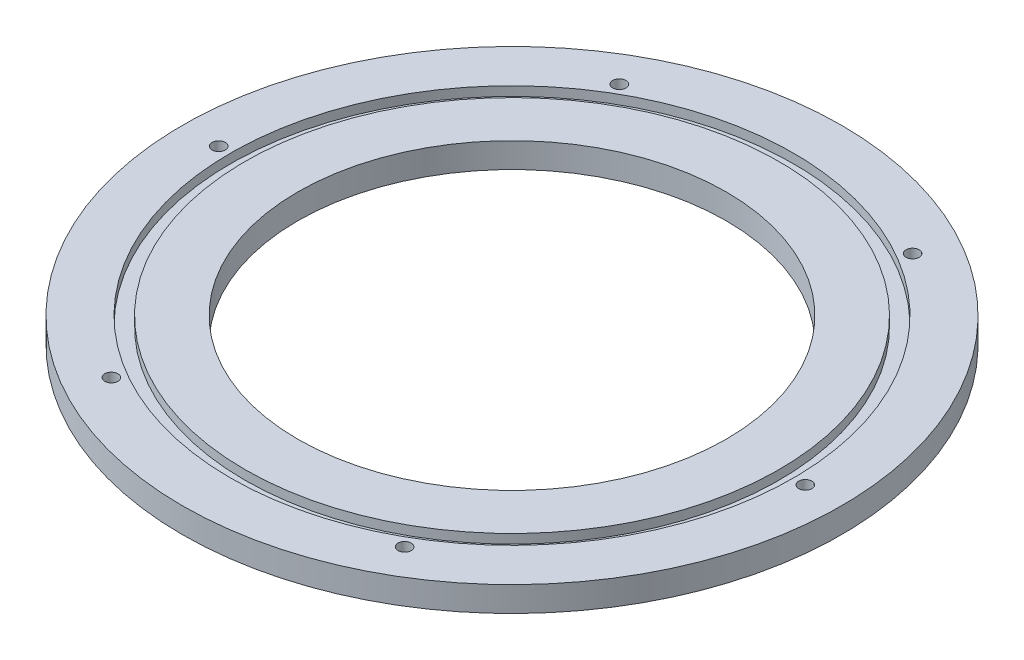
from build123d import *

# Parameters (mm, degrees)
SKETCH1_R           = 250
SKETCH1_R_2         = 162.5
BOSS_EXTRUDE1_DEPTH = 9.5
SKETCH2_R           = 213.5
SKETCH2_R_2         = 202.5
CUT_EXTRUDE1_DEPTH  = 7
SKETCH3_R           = 5
CUT_EXTRUDE2_DEPTH  = 355.063553617


with BuildPart() as part:
    # Sketch1 → Boss-Extrude1 (new, symmetric)
    with BuildSketch(Plane(origin=(0, 0, 0), x_dir=(1, 0, 0), z_dir=(0, 1, 0))):
        with Locations(Location((0, 0, 0), (0, 0, 270))):
            Circle(SKETCH1_R)
        with Locations(Location((0, 0, 0), (0, 0, 270))):
            Circle(SKETCH1_R_2, mode=Mode.SUBTRACT)
    extrude(amount=BOSS_EXTRUDE1_DEPTH, both=True)

    # Sketch2 → Cut-Extrude1 (cut)
    with BuildSketch(Plane(origin=(0, 9.5, 0), x_dir=(1, 0, 0), z_dir=(0, 1, 0))):
        with Locations(Location((0, 0, 0), (0, 0, 270))):
            Circle(SKETCH2_R)
        with Locations(Location((0, 0, 0), (0, 0, 270))):
            Circle(SKETCH2_R_2, mode=Mode.SUBTRACT)
    extrude(amount=-CUT_EXTRUDE1_DEPTH, mode=Mode.SUBTRACT)

    # Sketch3 → Cut-Extrude2 (cut, through all)
    with BuildSketch(Plane.XZ.offset(9.5)):
        with Locations(Location((111.25, 192.690652342, 0), (0, 0, 270))):
            Circle(SKETCH3_R)
        with Locations(Location((222.5, 0, 0), (0, 0, 270))):
            Circle(SKETCH3_R)
        with Locations(Location((-222.5, 0, 0), (0, 0, 90))):
            Circle(SKETCH3_R)
        with Locations(Location((-111.25, 192.690652342, 0), (0, 0, 90))):
            Circle(SKETCH3_R)
        with Locations(Location((-111.25, -192.690652342, 0), (0, 0, 270))):
            Circle(SKETCH3_R)
        with Locations(Location((111.25, -192.690652342, 0), (0, 0, 90))):
            Circle(SKETCH3_R)
    extrude(amount=-CUT_EXTRUDE2_DEPTH, mode=Mode.SUBTRACT)


solid = part.part
